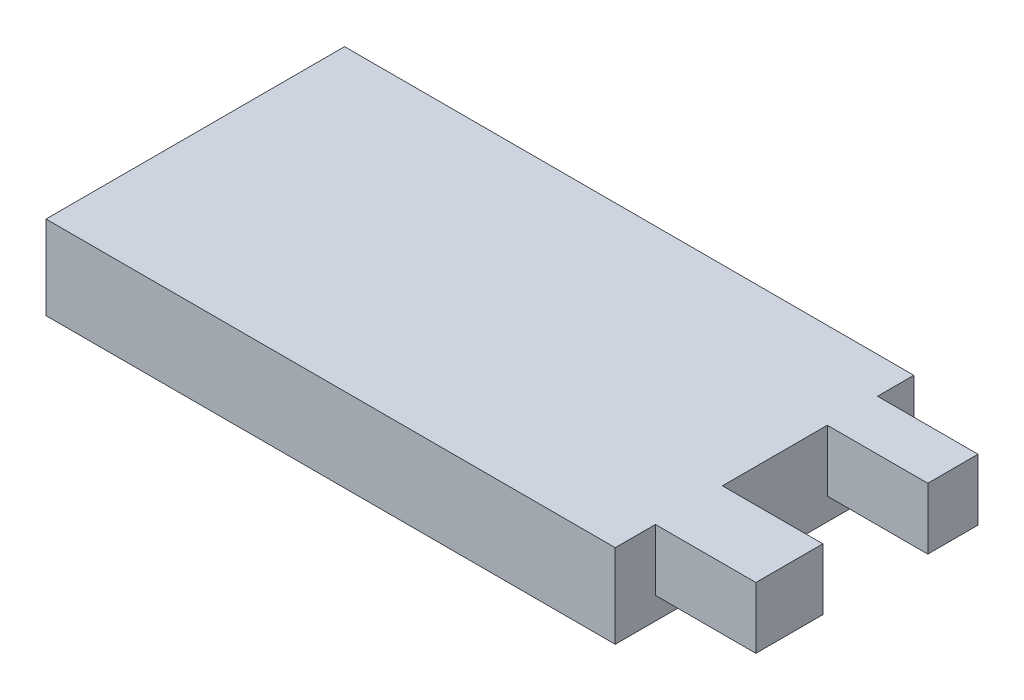
from build123d import *

# Parameters (mm, degrees)
CROQUIS1_W              = 102
CROQUIS1_H              = 53.5
SALIENTE_EXTRUIR1_DEPTH = 15
CROQUIS2_W              = 12
CROQUIS2_H              = 11
CROQUIS2_W_2            = 9
SALIENTE_EXTRUIR2_DEPTH = 18


with BuildPart() as part:
    # Croquis1 → Saliente-Extruir1 (new body)
    with BuildSketch(Plane(origin=(0, 0, 0), x_dir=(1, 0, 0), z_dir=(0, 1, 0))):
        Rectangle(CROQUIS1_W, CROQUIS1_H)
    extrude(amount=SALIENTE_EXTRUIR1_DEPTH)

    # Croquis2 → Saliente-Extruir2 (add)
    with BuildSketch(Plane(origin=(51, 0, 0), x_dir=(0, 0, -1), z_dir=(1, 0, 0))):
        with Locations((-13.55, 9.5)):
            Rectangle(CROQUIS2_W, CROQUIS2_H)
        with Locations((15.75, 9.5)):
            Rectangle(CROQUIS2_W_2, CROQUIS2_H)
    extrude(amount=SALIENTE_EXTRUIR2_DEPTH)


solid = part.part
